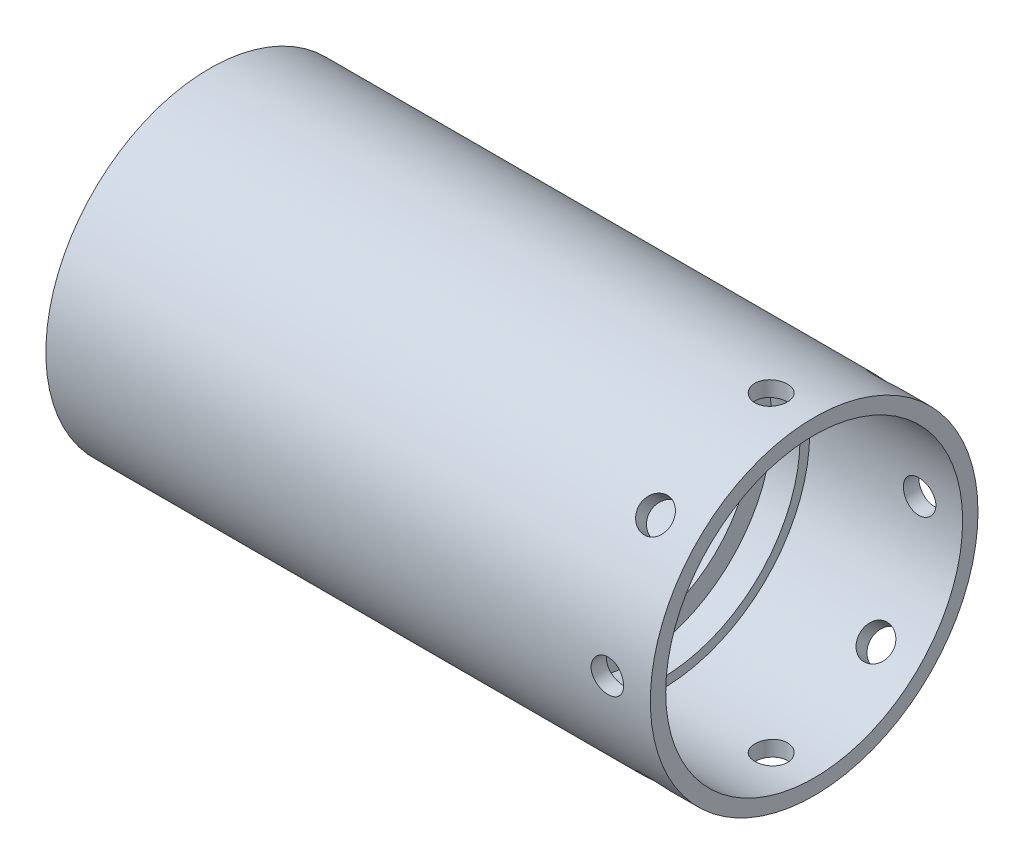
from build123d import *

# Parameters (mm, degrees)
BOSS_EXTRUDE1_DEPTH      = 55.88
BOSS_EXTRUDE1_DEPTH_BACK = 131.572
SKETCH1_R                = 50.8
SKETCH1_R_2              = 46.0375
BOSS_EXTRUDE2_DEPTH      = 8.636
BOSS_EXTRUDE2_DEPTH_BACK = 131.572
SKETCH1_3_R              = 45.847
SKETCH1_3_R_2            = 42.8625
SKETCH3_W                = 5.0419
SKETCH3_H                = 50.8
CIRPATTERN1_COUNT        = 8
SKETCH1_5_R              = 42.8625
SKETCH1_5_R_2            = 36.4109
BOSS_EXTRUDE4_DEPTH      = 131.572


with BuildPart() as part:
    # Sketch1 → Boss-Extrude1 (new, two sides: drawn at the far end of the back side and taken through both)
    with BuildSketch(Plane(origin=(0, 0, 0), x_dir=(0, 0, -1), z_dir=(1, 0, 0)).offset(-BOSS_EXTRUDE1_DEPTH_BACK)):
        Circle(SKETCH1_R)
        Circle(SKETCH1_R_2, mode=Mode.SUBTRACT)
    extrude(amount=BOSS_EXTRUDE1_DEPTH + BOSS_EXTRUDE1_DEPTH_BACK)

    # Sketch3 → Tap Drill for 3/8 Helicoil1 (revolve, cut)
    with BuildSketch(Plane(origin=(42.545, 0, 0), x_dir=(0, -1, 0), z_dir=(1, 0, 0))):
        with Locations((2.52095, 25.4)):
            Rectangle(SKETCH3_W, SKETCH3_H)
    tap_drill_for_3_8_helicoil1 = revolve(axis=Axis((42.545, 0, 6.35), (0, 0, -1)), mode=Mode.SUBTRACT)

    # CirPattern1: Tap Drill for 3/8 Helicoil1 ×8 about axis
    cirpattern1_axis = Axis((74.60738497, 0, 0), (-1, 0, 0))
    for i in range(1, CIRPATTERN1_COUNT):
        add(tap_drill_for_3_8_helicoil1.rotate(cirpattern1_axis, i * 360 / CIRPATTERN1_COUNT), mode=Mode.SUBTRACT)


with BuildPart() as body_2:
    # Sketch1<3> → Boss-Extrude2 (new, two sides: drawn at the far end of the back side and taken through both)
    with BuildSketch(Plane(origin=(0, 0, 0), x_dir=(0, 0, -1), z_dir=(1, 0, 0)).offset(-BOSS_EXTRUDE2_DEPTH_BACK)):
        Circle(SKETCH1_3_R)
        Circle(SKETCH1_3_R_2, mode=Mode.SUBTRACT)
    extrude(amount=BOSS_EXTRUDE2_DEPTH + BOSS_EXTRUDE2_DEPTH_BACK)


with BuildPart() as body_3:
    # Sketch1<5> → Boss-Extrude4 (new body)
    with BuildSketch(Plane(origin=(0, 0, 0), x_dir=(0, 0, -1), z_dir=(1, 0, 0))):
        Circle(SKETCH1_5_R)
        Circle(SKETCH1_5_R_2, mode=Mode.SUBTRACT)
    extrude(amount=-BOSS_EXTRUDE4_DEPTH)


solid = Compound([part.part, body_2.part, body_3.part])
